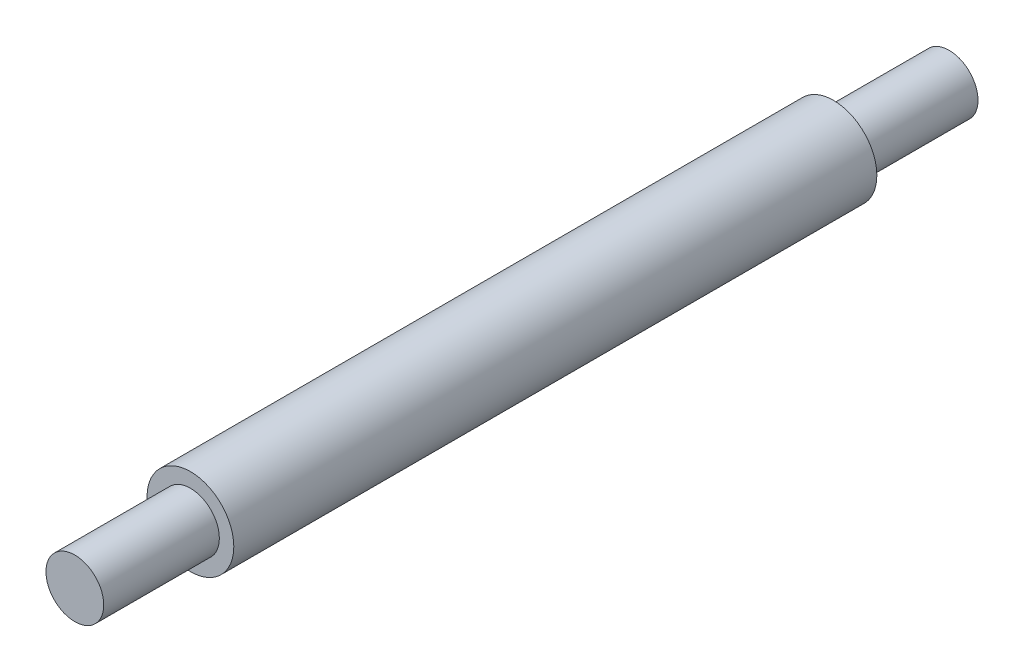
from build123d import *

# Parameters (mm, degrees)
SKETCH1_R           = 3
BOSS_EXTRUDE1_DEPTH = 44.5
SKETCH2_R           = 2
BOSS_EXTRUDE2_DEPTH = 8
BOSS_EXTRUDE3_START = 8
SKETCH3_R           = 2
BOSS_EXTRUDE3_DEPTH = 8


with BuildPart() as part:
    # Sketch1 → Boss-Extrude1 (new body)
    with BuildSketch(Plane.XY):
        Circle(SKETCH1_R)
    extrude(amount=BOSS_EXTRUDE1_DEPTH)

    # Sketch2 → Boss-Extrude2 (add)
    with BuildSketch(Plane.XY.offset(44.5)):
        Circle(SKETCH2_R)
    extrude(amount=BOSS_EXTRUDE2_DEPTH)

    # Sketch3 → Boss-Extrude3 (add)
    with BuildSketch(Plane(origin=(0, 0, 0), x_dir=(-1, 0, 0), z_dir=(0, 0, -1)).offset(BOSS_EXTRUDE3_START)):
        with Locations(Location((0, 0, 0), (0, 0, 180))):
            Circle(SKETCH3_R)
    extrude(amount=-BOSS_EXTRUDE3_DEPTH)


solid = part.part
